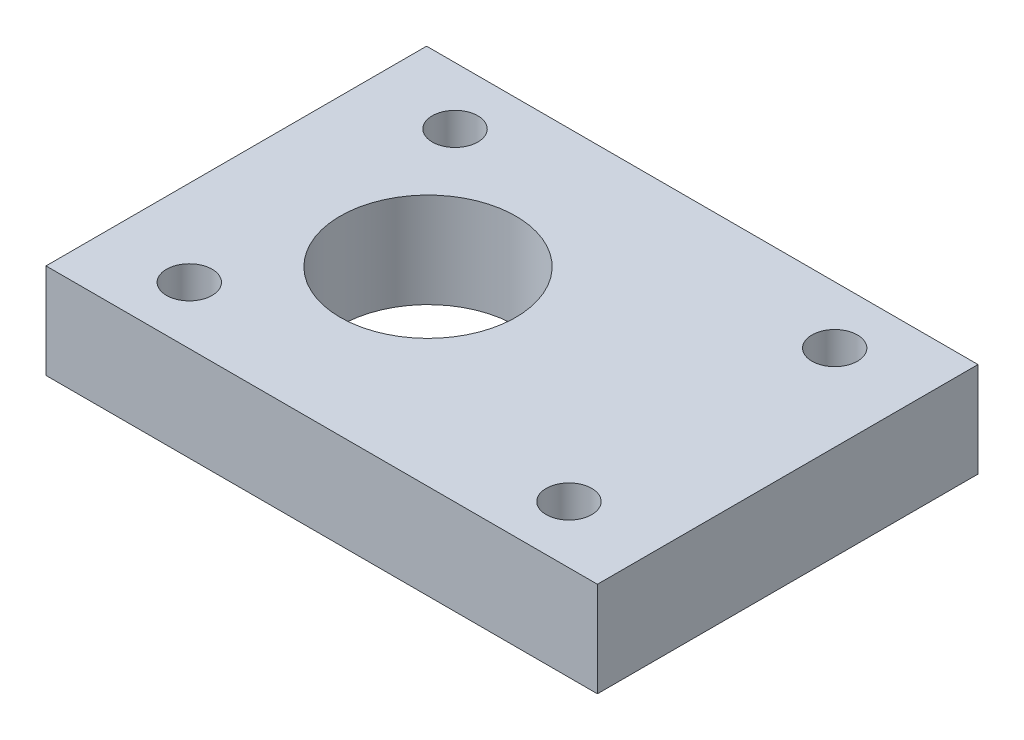
from build123d import *

# Parameters (mm, degrees)
SKETCH1_W           = 58.1
SKETCH1_H           = 40.1
BOSS_EXTRUDE1_DEPTH = 10
SKETCH1_7_R         = 9.25
CUT_EXTRUDE1_DEPTH  = 10
SKETCH1_8_R         = 2.4
CUT_EXTRUDE2_DEPTH  = 10


with BuildPart() as part:
    # Sketch1 → Boss-Extrude1 (new body)
    with BuildSketch(Plane(origin=(0, 0, 0), x_dir=(1, 0, 0), z_dir=(0, 1, 0))):
        with Locations((40.179637899, 24.108385802)):
            Rectangle(SKETCH1_W, SKETCH1_H)
    extrude(amount=BOSS_EXTRUDE1_DEPTH)

    # Sketch1<7> → Cut-Extrude1 (cut)
    with BuildSketch(Plane(origin=(0, 0, 0), x_dir=(1, 0, 0), z_dir=(0, 1, 0))):
        with Locations((31.329637899, 24.108385802)):
            Circle(SKETCH1_7_R)
    extrude(amount=CUT_EXTRUDE1_DEPTH, mode=Mode.SUBTRACT)

    # Sketch1<8> → Cut-Extrude2 (cut)
    with BuildSketch(Plane(origin=(0, 0, 0), x_dir=(1, 0, 0), z_dir=(0, 1, 0))):
        with Locations((20.179637899, 38.108385802)):
            Circle(SKETCH1_8_R)
        with Locations((60.179637899, 38.108385802)):
            Circle(SKETCH1_8_R)
        with Locations((20.179637899, 10.108385802)):
            Circle(SKETCH1_8_R)
        with Locations((60.179637899, 10.108385802)):
            Circle(SKETCH1_8_R)
    extrude(amount=CUT_EXTRUDE2_DEPTH, mode=Mode.SUBTRACT)


solid = part.part
